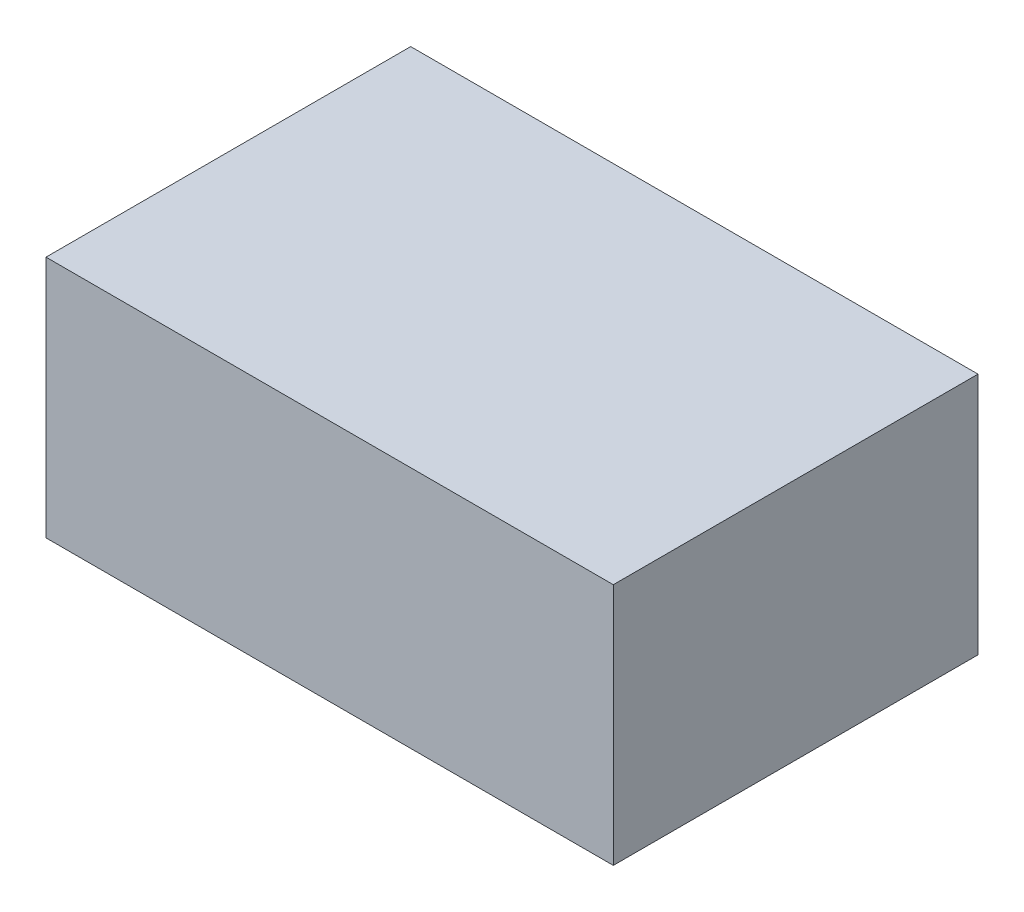
from build123d import *

# Parameters (mm, degrees)
SKETCH1_W           = 71.12
SKETCH1_H           = 45.72
BOSS_EXTRUDE1_DEPTH = 30.48


with BuildPart() as part:
    # Sketch1 → Boss-Extrude1 (new body)
    with BuildSketch(Plane(origin=(0, 0, 0), x_dir=(1, 0, 0), z_dir=(0, 1, 0))):
        with Locations((35.56, 22.86)):
            Rectangle(SKETCH1_W, SKETCH1_H)
    extrude(amount=BOSS_EXTRUDE1_DEPTH)


solid = part.part
